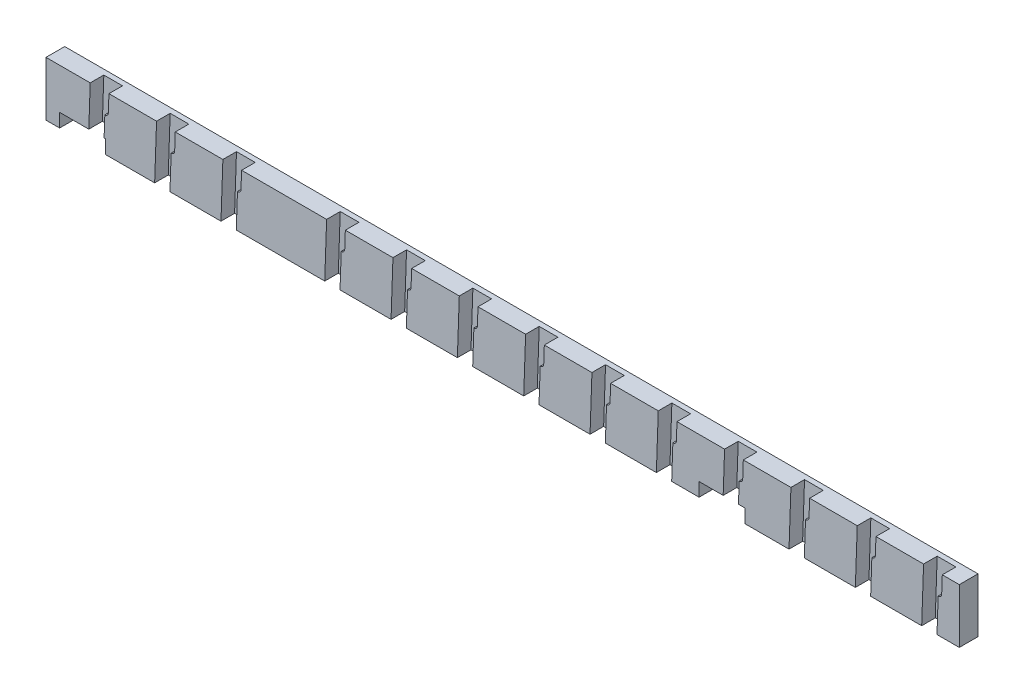
from build123d import *

# Parameters (mm, degrees)
SKETCH1_W           = 1704.975
SKETCH1_H           = 101.6
BOSS_EXTRUDE1_DEPTH = 34.925
CUT_EXTRUDE1_DEPTH  = 25.4
SKETCH3_W           = 85.725
SKETCH3_H           = 25.4
CUT_EXTRUDE2_DEPTH  = 855.713597225


with BuildPart() as part:
    # Sketch1 → Boss-Extrude1 (new body)
    with BuildSketch(Plane.XY):
        Rectangle(SKETCH1_W, SKETCH1_H)
    extrude(amount=BOSS_EXTRUDE1_DEPTH)

    # Sketch2 → Cut-Extrude1 (cut)
    with BuildSketch(Plane.XY.offset(34.925)):
        with BuildLine():
            Line((782.26454982, -50.8), (785.8125, 50.8))
            Line((785.8125, 50.8), (820.7375, 50.8))
            Line((820.7375, 50.8), (819.621026714, 18.828388196))
            ThreePointArc((819.621026714, 18.828388196), (817.685975615, 14.482192268), (813.274894962, 12.7))
            Line((813.274894962, 12.7), (813.057018682, 12.7))
            Line((813.057018682, 12.7), (810.83954982, -50.8))
            Line((810.83954982, -50.8), (782.26454982, -50.8))
        make_face()
        with BuildLine():
            Line((658.43954982, -50.8), (661.9875, 50.8))
            Line((661.9875, 50.8), (696.9125, 50.8))
            Line((696.9125, 50.8), (695.796026714, 18.828388196))
            ThreePointArc((695.796026714, 18.828388196), (693.860975615, 14.482192268), (689.449894962, 12.7))
            Line((689.449894962, 12.7), (689.232018682, 12.7))
            Line((689.232018682, 12.7), (687.01454982, -50.8))
            Line((687.01454982, -50.8), (658.43954982, -50.8))
        make_face()
        with BuildLine():
            Line((534.61454982, -50.8), (538.1625, 50.8))
            Line((538.1625, 50.8), (573.0875, 50.8))
            Line((573.0875, 50.8), (571.971026714, 18.828388196))
            ThreePointArc((571.971026714, 18.828388196), (570.035975615, 14.482192268), (565.624894962, 12.7))
            Line((565.624894962, 12.7), (565.407018682, 12.7))
            Line((565.407018682, 12.7), (563.18954982, -50.8))
            Line((563.18954982, -50.8), (534.61454982, -50.8))
        make_face()
        with BuildLine():
            Line((410.78954982, -50.8), (414.3375, 50.8))
            Line((414.3375, 50.8), (449.2625, 50.8))
            Line((449.2625, 50.8), (448.146026714, 18.828388196))
            ThreePointArc((448.146026714, 18.828388196), (446.210975615, 14.482192268), (441.799894962, 12.7))
            Line((441.799894962, 12.7), (441.582018682, 12.7))
            Line((441.582018682, 12.7), (439.36454982, -50.8))
            Line((439.36454982, -50.8), (410.78954982, -50.8))
        make_face()
        with BuildLine():
            Line((286.96454982, -50.8), (290.5125, 50.8))
            Line((290.5125, 50.8), (325.4375, 50.8))
            Line((325.4375, 50.8), (324.321026714, 18.828388196))
            ThreePointArc((324.321026714, 18.828388196), (322.385975615, 14.482192268), (317.974894962, 12.7))
            Line((317.974894962, 12.7), (317.757018682, 12.7))
            Line((317.757018682, 12.7), (315.53954982, -50.8))
            Line((315.53954982, -50.8), (286.96454982, -50.8))
        make_face()
        with BuildLine():
            Line((163.13954982, -50.8), (166.6875, 50.8))
            Line((166.6875, 50.8), (201.6125, 50.8))
            Line((201.6125, 50.8), (200.496026714, 18.828388196))
            ThreePointArc((200.496026714, 18.828388196), (198.560975615, 14.482192268), (194.149894962, 12.7))
            Line((194.149894962, 12.7), (193.932018682, 12.7))
            Line((193.932018682, 12.7), (191.71454982, -50.8))
            Line((191.71454982, -50.8), (163.13954982, -50.8))
        make_face()
        with BuildLine():
            Line((39.31454982, -50.8), (42.8625, 50.8))
            Line((42.8625, 50.8), (77.7875, 50.8))
            Line((77.7875, 50.8), (76.671026714, 18.828388196))
            ThreePointArc((76.671026714, 18.828388196), (74.735975615, 14.482192268), (70.324894962, 12.7))
            Line((70.324894962, 12.7), (70.107018682, 12.7))
            Line((70.107018682, 12.7), (67.88954982, -50.8))
            Line((67.88954982, -50.8), (39.31454982, -50.8))
        make_face()
        with BuildLine():
            Line((-84.51045018, -50.8), (-80.9625, 50.8))
            Line((-80.9625, 50.8), (-46.0375, 50.8))
            Line((-46.0375, 50.8), (-47.153973286, 18.828388196))
            ThreePointArc((-47.153973286, 18.828388196), (-49.089024385, 14.482192268), (-53.500105038, 12.7))
            Line((-53.500105038, 12.7), (-53.717981318, 12.7))
            Line((-53.717981318, 12.7), (-55.93545018, -50.8))
            Line((-55.93545018, -50.8), (-84.51045018, -50.8))
        make_face()
        with BuildLine():
            Line((-208.33545018, -50.8), (-204.7875, 50.8))
            Line((-204.7875, 50.8), (-169.8625, 50.8))
            Line((-169.8625, 50.8), (-170.978973286, 18.828388196))
            ThreePointArc((-170.978973286, 18.828388196), (-172.914024385, 14.482192268), (-177.325105038, 12.7))
            Line((-177.325105038, 12.7), (-177.542981318, 12.7))
            Line((-177.542981318, 12.7), (-179.76045018, -50.8))
            Line((-179.76045018, -50.8), (-208.33545018, -50.8))
        make_face()
        with BuildLine():
            Line((-332.16045018, -50.8), (-328.6125, 50.8))
            Line((-328.6125, 50.8), (-293.6875, 50.8))
            Line((-293.6875, 50.8), (-294.803973286, 18.828388196))
            ThreePointArc((-294.803973286, 18.828388196), (-296.739024385, 14.482192268), (-301.150105038, 12.7))
            Line((-301.150105038, 12.7), (-301.367981318, 12.7))
            Line((-301.367981318, 12.7), (-303.58545018, -50.8))
            Line((-303.58545018, -50.8), (-332.16045018, -50.8))
        make_face()
        with BuildLine():
            Line((-525.83545018, -50.8), (-522.2875, 50.8))
            Line((-522.2875, 50.8), (-487.3625, 50.8))
            Line((-487.3625, 50.8), (-488.478973286, 18.828388196))
            ThreePointArc((-488.478973286, 18.828388196), (-490.414024385, 14.482192268), (-494.825105038, 12.7))
            Line((-494.825105038, 12.7), (-495.042981318, 12.7))
            Line((-495.042981318, 12.7), (-497.26045018, -50.8))
            Line((-497.26045018, -50.8), (-525.83545018, -50.8))
        make_face()
        with BuildLine():
            Line((-649.66045018, -50.8), (-646.1125, 50.8))
            Line((-646.1125, 50.8), (-611.1875, 50.8))
            Line((-611.1875, 50.8), (-612.303973286, 18.828388196))
            ThreePointArc((-612.303973286, 18.828388196), (-614.239024385, 14.482192268), (-618.650105038, 12.7))
            Line((-618.650105038, 12.7), (-618.867981318, 12.7))
            Line((-618.867981318, 12.7), (-621.08545018, -50.8))
            Line((-621.08545018, -50.8), (-649.66045018, -50.8))
        make_face()
        with BuildLine():
            Line((-773.48545018, -50.8), (-769.9375, 50.8))
            Line((-769.9375, 50.8), (-735.0125, 50.8))
            Line((-735.0125, 50.8), (-736.128973286, 18.828388196))
            ThreePointArc((-736.128973286, 18.828388196), (-738.064024385, 14.482192268), (-742.475105038, 12.7))
            Line((-742.475105038, 12.7), (-742.692981318, 12.7))
            Line((-742.692981318, 12.7), (-744.91045018, -50.8))
            Line((-744.91045018, -50.8), (-773.48545018, -50.8))
        make_face()
    extrude(amount=-CUT_EXTRUDE1_DEPTH, mode=Mode.SUBTRACT)

    # Sketch3 → Cut-Extrude2 (cut, through all)
    with BuildSketch(Plane(origin=(0, 0, 0), x_dir=(-1, 0, 0), z_dir=(0, 0, -1))):
        with Locations((784.225, -38.1)):
            Rectangle(SKETCH3_W, SKETCH3_H)
        with Locations((-409.575, -38.1)):
            Rectangle(SKETCH3_W, SKETCH3_H)
    extrude(amount=-CUT_EXTRUDE2_DEPTH, mode=Mode.SUBTRACT)


solid = part.part
